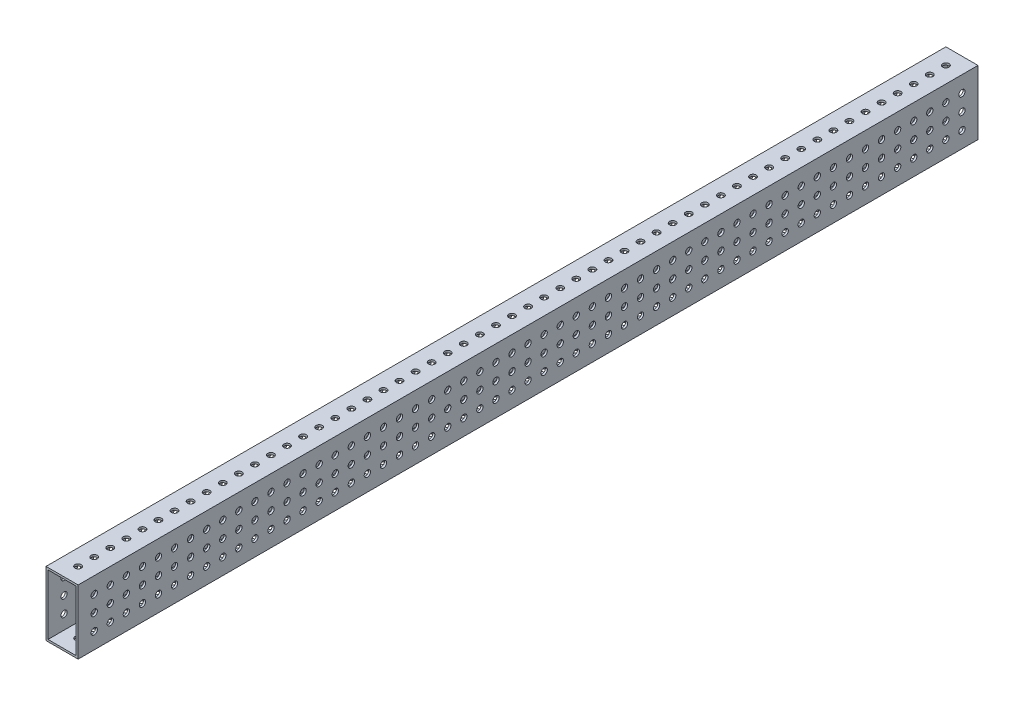
from build123d import *

# Parameters (mm, degrees)
SKETCH1_W           = 25.4
SKETCH1_H           = 50.8
SKETCH1_W_2         = 22.225
SKETCH1_H_2         = 47.625
BOSS_EXTRUDE1_DEPTH = 355.6
SKETCH2_R           = 2.4892
CUT_EXTRUDE1_DEPTH  = 361.10715072
LPATTERN1_COUNT     = 55
LPATTERN1_PITCH     = 12.7
SKETCH3_R           = 2.4892
CUT_EXTRUDE2_DEPTH  = 361.10715072


with BuildPart() as part:
    # Sketch1 → Boss-Extrude1 (new, symmetric)
    with BuildSketch(Plane.XY):
        with Locations((12.7, 25.4)):
            Rectangle(SKETCH1_W, SKETCH1_H)
        with Locations((12.7, 25.4)):
            Rectangle(SKETCH1_W_2, SKETCH1_H_2, mode=Mode.SUBTRACT)
    extrude(amount=BOSS_EXTRUDE1_DEPTH, both=True)

    # Sketch2 → Cut-Extrude1 (cut, through all)
    with BuildSketch(Plane.ZY):
        with Locations((-342.9, 38.1)):
            Circle(SKETCH2_R)
        with Locations((-342.9, 25.4)):
            Circle(SKETCH2_R)
        with Locations((-342.9, 12.7)):
            Circle(SKETCH2_R)
    cut_extrude1 = extrude(amount=-CUT_EXTRUDE1_DEPTH, mode=Mode.SUBTRACT)

    # LPattern1: Cut-Extrude1 ×55
    with Locations(*[(0, 0, i * LPATTERN1_PITCH) for i in range(1, LPATTERN1_COUNT)]):
        add(cut_extrude1, mode=Mode.SUBTRACT)

    # Sketch3 → Cut-Extrude2 (cut, through all)
    with BuildSketch(Plane(origin=(0, 50.8, 0), x_dir=(1, 0, 0), z_dir=(0, 1, 0))):
        with Locations(Location((12.7, 342.9, 0), (0, 0, 270))):
            Circle(SKETCH3_R)
        with Locations(Location((12.7, 330.2, 0), (0, 0, 270))):
            Circle(SKETCH3_R)
        with Locations(Location((12.7, 317.5, 0), (0, 0, 270))):
            Circle(SKETCH3_R)
        with Locations(Location((12.7, 304.8, 0), (0, 0, 270))):
            Circle(SKETCH3_R)
        with Locations(Location((12.7, 292.1, 0), (0, 0, 270))):
            Circle(SKETCH3_R)
        with Locations(Location((12.7, 279.4, 0), (0, 0, 270))):
            Circle(SKETCH3_R)
        with Locations(Location((12.7, 266.7, 0), (0, 0, 270))):
            Circle(SKETCH3_R)
        with Locations(Location((12.7, 254, 0), (0, 0, 270))):
            Circle(SKETCH3_R)
        with Locations(Location((12.7, 241.3, 0), (0, 0, 270))):
            Circle(SKETCH3_R)
        with Locations(Location((12.7, 228.6, 0), (0, 0, 270))):
            Circle(SKETCH3_R)
        with Locations(Location((12.7, 215.9, 0), (0, 0, 270))):
            Circle(SKETCH3_R)
        with Locations(Location((12.7, 203.2, 0), (0, 0, 270))):
            Circle(SKETCH3_R)
        with Locations(Location((12.7, 190.5, 0), (0, 0, 270))):
            Circle(SKETCH3_R)
        with Locations(Location((12.7, 177.8, 0), (0, 0, 270))):
            Circle(SKETCH3_R)
        with Locations(Location((12.7, 165.1, 0), (0, 0, 270))):
            Circle(SKETCH3_R)
        with Locations(Location((12.7, 152.4, 0), (0, 0, 270))):
            Circle(SKETCH3_R)
        with Locations(Location((12.7, 139.7, 0), (0, 0, 270))):
            Circle(SKETCH3_R)
        with Locations(Location((12.7, 127, 0), (0, 0, 270))):
            Circle(SKETCH3_R)
        with Locations(Location((12.7, 114.3, 0), (0, 0, 270))):
            Circle(SKETCH3_R)
        with Locations(Location((12.7, 101.6, 0), (0, 0, 270))):
            Circle(SKETCH3_R)
        with Locations(Location((12.7, 88.9, 0), (0, 0, 270))):
            Circle(SKETCH3_R)
        with Locations(Location((12.7, 76.2, 0), (0, 0, 270))):
            Circle(SKETCH3_R)
        with Locations(Location((12.7, 63.5, 0), (0, 0, 270))):
            Circle(SKETCH3_R)
        with Locations(Location((12.7, 50.8, 0), (0, 0, 270))):
            Circle(SKETCH3_R)
        with Locations(Location((12.7, 38.1, 0), (0, 0, 270))):
            Circle(SKETCH3_R)
        with Locations(Location((12.7, 25.4, 0), (0, 0, 270))):
            Circle(SKETCH3_R)
        with Locations(Location((12.7, 12.7, 0), (0, 0, 270))):
            Circle(SKETCH3_R)
        with Locations(Location((12.7, 0, 0), (0, 0, 270))):
            Circle(SKETCH3_R)
        with Locations(Location((12.7, -12.7, 0), (0, 0, 270))):
            Circle(SKETCH3_R)
        with Locations(Location((12.7, -25.4, 0), (0, 0, 270))):
            Circle(SKETCH3_R)
        with Locations(Location((12.7, -38.1, 0), (0, 0, 270))):
            Circle(SKETCH3_R)
        with Locations(Location((12.7, -50.8, 0), (0, 0, 270))):
            Circle(SKETCH3_R)
        with Locations(Location((12.7, -63.5, 0), (0, 0, 270))):
            Circle(SKETCH3_R)
        with Locations(Location((12.7, -76.2, 0), (0, 0, 270))):
            Circle(SKETCH3_R)
        with Locations(Location((12.7, -88.9, 0), (0, 0, 270))):
            Circle(SKETCH3_R)
        with Locations(Location((12.7, -101.6, 0), (0, 0, 270))):
            Circle(SKETCH3_R)
        with Locations(Location((12.7, -114.3, 0), (0, 0, 270))):
            Circle(SKETCH3_R)
        with Locations(Location((12.7, -127, 0), (0, 0, 270))):
            Circle(SKETCH3_R)
        with Locations(Location((12.7, -139.7, 0), (0, 0, 270))):
            Circle(SKETCH3_R)
        with Locations(Location((12.7, -152.4, 0), (0, 0, 270))):
            Circle(SKETCH3_R)
        with Locations(Location((12.7, -165.1, 0), (0, 0, 270))):
            Circle(SKETCH3_R)
        with Locations(Location((12.7, -177.8, 0), (0, 0, 270))):
            Circle(SKETCH3_R)
        with Locations(Location((12.7, -190.5, 0), (0, 0, 270))):
            Circle(SKETCH3_R)
        with Locations(Location((12.7, -203.2, 0), (0, 0, 270))):
            Circle(SKETCH3_R)
        with Locations(Location((12.7, -215.9, 0), (0, 0, 270))):
            Circle(SKETCH3_R)
        with Locations(Location((12.7, -228.6, 0), (0, 0, 270))):
            Circle(SKETCH3_R)
        with Locations(Location((12.7, -241.3, 0), (0, 0, 270))):
            Circle(SKETCH3_R)
        with Locations(Location((12.7, -254, 0), (0, 0, 270))):
            Circle(SKETCH3_R)
        with Locations(Location((12.7, -266.7, 0), (0, 0, 270))):
            Circle(SKETCH3_R)
        with Locations(Location((12.7, -279.4, 0), (0, 0, 270))):
            Circle(SKETCH3_R)
        with Locations(Location((12.7, -292.1, 0), (0, 0, 270))):
            Circle(SKETCH3_R)
        with Locations(Location((12.7, -304.8, 0), (0, 0, 270))):
            Circle(SKETCH3_R)
        with Locations(Location((12.7, -317.5, 0), (0, 0, 270))):
            Circle(SKETCH3_R)
        with Locations(Location((12.7, -330.2, 0), (0, 0, 270))):
            Circle(SKETCH3_R)
        with Locations(Location((12.7, -342.9, 0), (0, 0, 270))):
            Circle(SKETCH3_R)
    extrude(amount=-CUT_EXTRUDE2_DEPTH, mode=Mode.SUBTRACT)


solid = part.part
